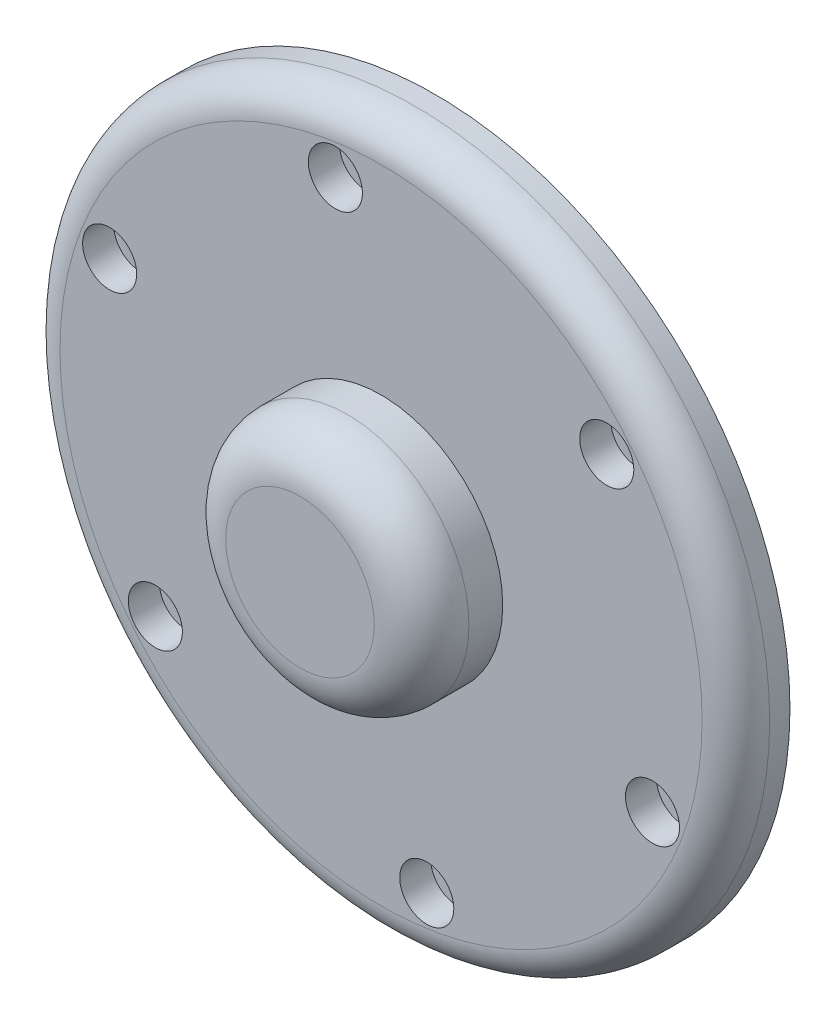
from build123d import *

# Parameters (mm, degrees)
SKETCH_1_R                   = 52.5
EXTRUDE_1_DEPTH              = 20
CUT_EXTRUDE_START            = -12
SKETCH_3_R                   = 52.5
SKETCH_3_R_2                 = 18
CUT_EXTRUDE_1_DEPTH          = 12
SKETCH_5_R                   = 15.25
CUT_EXTRUDE_3_DEPTH          = 17.5
HOLE_WIZARD_M4_1_D           = 4.5
HOLE_WIZARD_M4_1_CBORE_D     = 8
HOLE_WIZARD_M4_1_CBORE_DEPTH = 4.6
PATTERN_CIRCULAR_1_COUNT     = 6
FILLET_2_R                   = 7
FILLET_3_R                   = 5


with BuildPart() as part:
    # 草图1 → 凸台-拉伸1 (new body)
    with BuildSketch(Plane.XY):
        Circle(SKETCH_1_R)
    extrude(amount=EXTRUDE_1_DEPTH)

    # 草图3 → 切除-拉伸1 (cut)
    with BuildSketch(Plane.XY.offset(20).offset(CUT_EXTRUDE_START)):
        Circle(SKETCH_3_R)
        Circle(SKETCH_3_R_2, mode=Mode.SUBTRACT)
    extrude(amount=CUT_EXTRUDE_1_DEPTH, mode=Mode.SUBTRACT)

    # 草图5 → 切除-拉伸3 (cut)
    with BuildSketch(Plane(origin=(0, 0, 0), x_dir=(-1, 0, 0), z_dir=(0, 0, -1))):
        with Locations((0, 0.647267044)):
            Circle(SKETCH_5_R)
    extrude(amount=-CUT_EXTRUDE_3_DEPTH, mode=Mode.SUBTRACT)

    # M4 六角圆柱头螺钉的柱形沉头孔1 (through all)
    with Locations(Plane.XY.offset(8)):
        with Locations((33.394511176, 27.088865302)):
            hole_wizard_m4_1 = CounterBoreHole(HOLE_WIZARD_M4_1_D / 2, HOLE_WIZARD_M4_1_CBORE_D / 2, HOLE_WIZARD_M4_1_CBORE_DEPTH)

    # 阵列(圆周)1: M4 六角圆柱头螺钉的柱形沉头孔1 ×6 about axis
    pattern_circular_1_axis = Axis((0, 0, 0), (0, 0, 1))
    for i in range(1, PATTERN_CIRCULAR_1_COUNT):
        add(hole_wizard_m4_1.rotate(pattern_circular_1_axis, i * 360 / PATTERN_CIRCULAR_1_COUNT), mode=Mode.SUBTRACT)

    # 圆角2
    fillet_2_edges = [part.edges().sort_by_distance(p)[0] for p in [
        (-18, 0, 20),
    ]]
    fillet(fillet_2_edges, radius=FILLET_2_R)

    # 圆角3
    fillet_3_edges = [part.edges().sort_by_distance(p)[0] for p in [
        (-52.5, 0, 8),
    ]]
    fillet(fillet_3_edges, radius=FILLET_3_R)


solid = part.part
